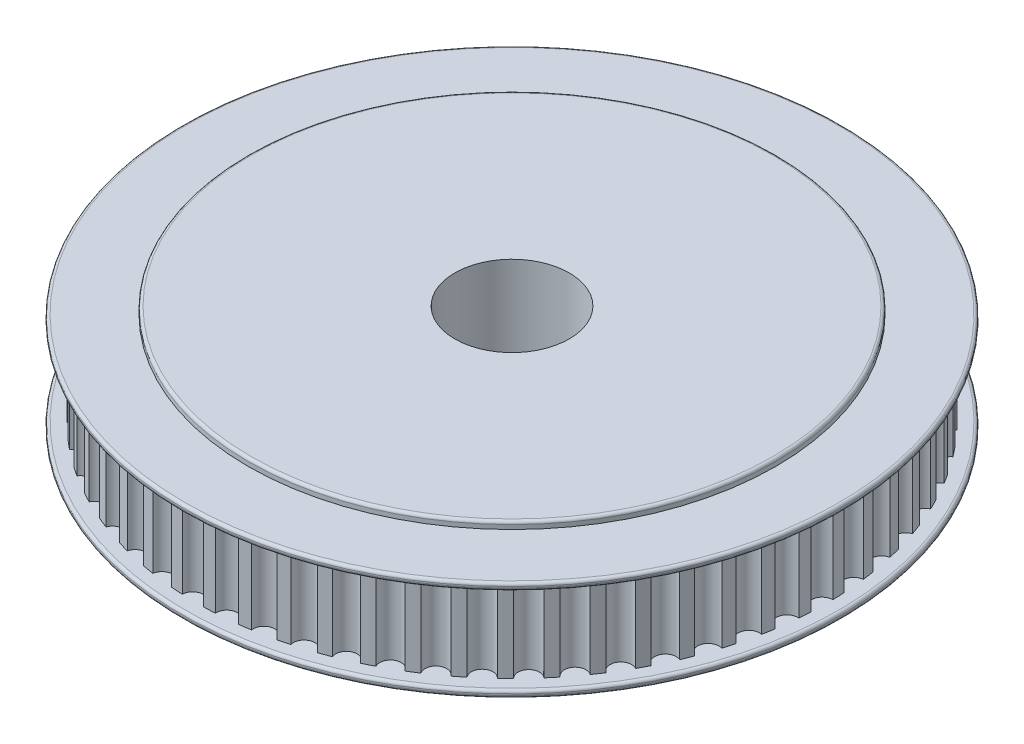
from build123d import *

# Parameters (mm, degrees)
SKETCH1_R           = 22
BOSS_EXTRUDE1_DEPTH = 6
SKETCH2_R           = 0.75
CUT_EXTRUDE1_DEPTH  = 6
SKETCH3_R           = 23.032388322
BOSS_EXTRUDE2_DEPTH = 0.5
SKETCH4_R           = 18.437790333
BOSS_EXTRUDE3_DEPTH = 0.5
BOSS_EXTRUDE4_START = 0.5
SKETCH5_R           = 23.032388322
BOSS_EXTRUDE4_DEPTH = 0.5
SKETCH6_R           = 12.5
BOSS_EXTRUDE5_DEPTH = 6
FILLET2_R           = 0.2
SKETCH7_R           = 4
CUT_EXTRUDE2_DEPTH  = 36.259492805


with BuildPart() as part:
    # Sketch1 → Boss-Extrude1 (new body)
    with BuildSketch(Plane(origin=(0, 0, 0), x_dir=(1, 0, 0), z_dir=(0, 1, 0))):
        with Locations(Location((0, 0, 0), (0, 0, 270))):
            Circle(SKETCH1_R)
    extrude(amount=BOSS_EXTRUDE1_DEPTH)

    # Sketch2 → Cut-Extrude1 (cut)
    with BuildSketch(Plane(origin=(0, 6, 0), x_dir=(1, 0, 0), z_dir=(0, 1, 0))):
        with Locations((-4.259292275, 21.583753828)):
            Circle(SKETCH2_R)
        with Locations((-1.979842807, 21.910733042)):
            Circle(SKETCH2_R)
        with Locations((0.321298233, 21.99765368)):
            Circle(SKETCH2_R)
        with Locations((2.618919062, 21.843563421)):
            Circle(SKETCH2_R)
        with Locations((4.887846466, 21.45015051)):
            Circle(SKETCH2_R)
        with Locations((7.103221602, 20.821725262)):
            Circle(SKETCH2_R)
        with Locations((9.240772355, 19.965172834)):
            Circle(SKETCH2_R)
        with Locations((11.277079272, 18.889877794)):
            Circle(SKETCH2_R)
        with Locations((13.189832149, 17.607621301)):
            Circle(SKETCH2_R)
        with Locations((14.958074465, 16.132452024)):
            Circle(SKETCH2_R)
        with Locations((16.562432987, 14.480532226)):
            Circle(SKETCH2_R)
        with Locations((17.985330027, 12.669960688)):
            Circle(SKETCH2_R)
        with Locations((19.211176027, 10.720574408)):
            Circle(SKETCH2_R)
        with Locations((20.226540363, 8.653731272)):
            Circle(SKETCH2_R)
        with Locations((21.02029849, 6.492076046)):
            Circle(SKETCH2_R)
        with Locations((21.583753828, 4.259292275)):
            Circle(SKETCH2_R)
        with Locations((21.910733042, 1.979842807)):
            Circle(SKETCH2_R)
        with Locations((21.99765368, -0.321298233)):
            Circle(SKETCH2_R)
        with Locations((21.843563421, -2.618919062)):
            Circle(SKETCH2_R)
        with Locations((21.45015051, -4.887846466)):
            Circle(SKETCH2_R)
        with Locations((20.821725262, -7.103221602)):
            Circle(SKETCH2_R)
        with Locations((19.965172834, -9.240772355)):
            Circle(SKETCH2_R)
        with Locations((18.889877794, -11.277079272)):
            Circle(SKETCH2_R)
        with Locations((17.607621301, -13.189832149)):
            Circle(SKETCH2_R)
        with Locations((16.132452024, -14.958074465)):
            Circle(SKETCH2_R)
        with Locations((14.480532226, -16.562432987)):
            Circle(SKETCH2_R)
        with Locations((12.669960688, -17.985330027)):
            Circle(SKETCH2_R)
        with Locations((10.720574408, -19.211176027)):
            Circle(SKETCH2_R)
        with Locations((8.653731272, -20.226540363)):
            Circle(SKETCH2_R)
        with Locations((6.492076046, -21.02029849)):
            Circle(SKETCH2_R)
        with Locations((4.259292275, -21.583753828)):
            Circle(SKETCH2_R)
        with Locations((1.979842807, -21.910733042)):
            Circle(SKETCH2_R)
        with Locations((-0.321298233, -21.99765368)):
            Circle(SKETCH2_R)
        with Locations((-2.618919062, -21.843563421)):
            Circle(SKETCH2_R)
        with Locations((-4.887846466, -21.45015051)):
            Circle(SKETCH2_R)
        with Locations((-7.103221602, -20.821725262)):
            Circle(SKETCH2_R)
        with Locations((-9.240772355, -19.965172834)):
            Circle(SKETCH2_R)
        with Locations((-11.277079272, -18.889877794)):
            Circle(SKETCH2_R)
        with Locations((-13.189832149, -17.607621301)):
            Circle(SKETCH2_R)
        with Locations((-14.958074465, -16.132452024)):
            Circle(SKETCH2_R)
        with Locations((-16.562432987, -14.480532226)):
            Circle(SKETCH2_R)
        with Locations((-17.985330027, -12.669960688)):
            Circle(SKETCH2_R)
        with Locations((-19.211176027, -10.720574408)):
            Circle(SKETCH2_R)
        with Locations((-20.226540363, -8.653731272)):
            Circle(SKETCH2_R)
        with Locations((-21.02029849, -6.492076046)):
            Circle(SKETCH2_R)
        with Locations((-21.583753828, -4.259292275)):
            Circle(SKETCH2_R)
        with Locations((-21.910733042, -1.979842807)):
            Circle(SKETCH2_R)
        with Locations((-21.99765368, 0.321298233)):
            Circle(SKETCH2_R)
        with Locations((-21.843563421, 2.618919062)):
            Circle(SKETCH2_R)
        with Locations((-21.45015051, 4.887846466)):
            Circle(SKETCH2_R)
        with Locations((-20.821725262, 7.103221602)):
            Circle(SKETCH2_R)
        with Locations((-19.965172834, 9.240772355)):
            Circle(SKETCH2_R)
        with Locations((-18.889877794, 11.277079272)):
            Circle(SKETCH2_R)
        with Locations((-17.607621301, 13.189832149)):
            Circle(SKETCH2_R)
        with Locations((-16.132452024, 14.958074465)):
            Circle(SKETCH2_R)
        with Locations((-14.480532226, 16.562432987)):
            Circle(SKETCH2_R)
        with Locations((-12.669960688, 17.985330027)):
            Circle(SKETCH2_R)
        with Locations((-10.720574408, 19.211176027)):
            Circle(SKETCH2_R)
        with Locations((-8.653731272, 20.226540363)):
            Circle(SKETCH2_R)
        with Locations((-6.492076046, 21.02029849)):
            Circle(SKETCH2_R)
    extrude(amount=-CUT_EXTRUDE1_DEPTH, mode=Mode.SUBTRACT)

    # Sketch3 → Boss-Extrude2 (add)
    with BuildSketch(Plane(origin=(0, 6, 0), x_dir=(1, 0, 0), z_dir=(0, 1, 0))):
        with Locations(Location((0, 0, 0), (0, 0, 270))):
            Circle(SKETCH3_R)
    extrude(amount=BOSS_EXTRUDE2_DEPTH)

    # Sketch4 → Boss-Extrude3 (add)
    with BuildSketch(Plane(origin=(0, 6.5, 0), x_dir=(1, 0, 0), z_dir=(0, 1, 0))):
        with Locations(Location((0, 0, 0), (0, 0, 270))):
            Circle(SKETCH4_R)
    extrude(amount=BOSS_EXTRUDE3_DEPTH)

    # Sketch5 → Boss-Extrude4 (add)
    with BuildSketch(Plane.XZ.offset(BOSS_EXTRUDE4_START)):
        with Locations(Location((0, 0, 0), (0, 0, 90))):
            Circle(SKETCH5_R)
    extrude(amount=-BOSS_EXTRUDE4_DEPTH)

    # Sketch6 → Boss-Extrude5 (add)
    with BuildSketch(Plane.XZ.offset(0.5)):
        with Locations(Location((0, 0, 0), (0, 0, 270))):
            Circle(SKETCH6_R)
    extrude(amount=BOSS_EXTRUDE5_DEPTH)

    # Fillet2
    fillet2_edges = [part.edges().sort_by_distance(p)[0] for p in [
        (0, 6, -23.032388322),
        (0, 6.5, -23.032388322),
        (0, 7, -18.437790333),
        (0, 0, -23.032388322),
        (0, -0.5, -23.032388322),
        (0, -6.5, 12.5),
    ]]
    fillet(fillet2_edges, radius=FILLET2_R)

    # Sketch7 → Cut-Extrude2 (cut, through all)
    with BuildSketch(Plane(origin=(0, 7, 0), x_dir=(1, 0, 0), z_dir=(0, 1, 0))):
        with Locations(Location((0, 0, 0), (0, 0, 270))):
            Circle(SKETCH7_R)
    extrude(amount=-CUT_EXTRUDE2_DEPTH, mode=Mode.SUBTRACT)


solid = part.part
